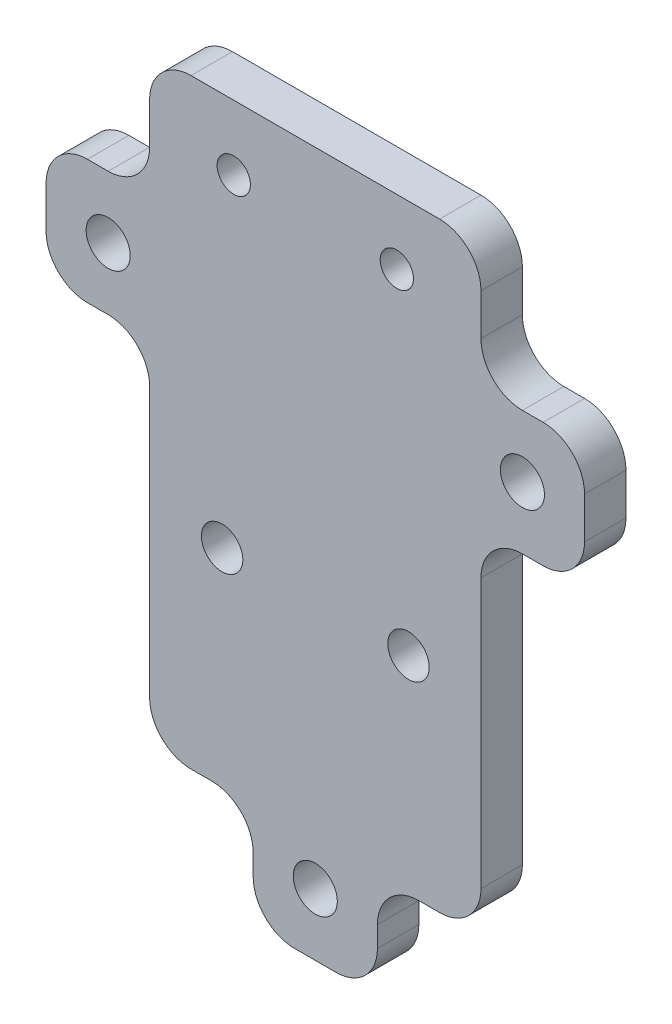
from build123d import *

# Parameters (mm, degrees)
SKETCH1_W                   = 50.8
SKETCH1_H                   = 101.6
BOSS_EXTRUDE1_DEPTH         = 6.35
F_7_0_201_DIAMETER_HOLE1_D  = 5.1054
SKETCH4_W                   = 15.875
SKETCH4_H                   = 19.05
SKETCH4_W_2                 = 19.05
SKETCH4_H_2                 = 15.875
BOSS_EXTRUDE2_DEPTH         = 6.35
F_1_4_CLEARANCE_HOLE1_D     = 6.7564
SKETCH7_W                   = 50.8
SKETCH7_H                   = 9.525
CUT_EXTRUDE1_DEPTH          = 122.689926144
FILLET1_R                   = 6.35
F_1_4_0_25_DIAMETER_HOLE1_D = 6.35


with BuildPart() as part:
    # Sketch1 → Boss-Extrude1 (new body)
    with BuildSketch(Plane.XY):
        with Locations((25.4, 50.8)):
            Rectangle(SKETCH1_W, SKETCH1_H)
    extrude(amount=BOSS_EXTRUDE1_DEPTH)

    # #7 (0.201) Diameter Hole1 (through all)
    with Locations(Plane.XY.offset(6.35)):
        with Locations((12.899999981, 82.13900006), (37.900000019, 82.13900006)):
            Hole(F_7_0_201_DIAMETER_HOLE1_D / 2)

    # Sketch4 → Boss-Extrude2 (add)
    with BuildSketch(Plane.XY.offset(6.35)):
        with Locations((-7.9375, 63.5)):
            Rectangle(SKETCH4_W, SKETCH4_H)
        with Locations((58.7375, 63.5)):
            Rectangle(SKETCH4_W, SKETCH4_H)
        with Locations((25.4, -7.9375)):
            Rectangle(SKETCH4_W_2, SKETCH4_H_2)
    extrude(amount=-BOSS_EXTRUDE2_DEPTH)

    # 1/4 Clearance Hole1 (through all)
    with Locations(Plane.XY.offset(6.35)):
        with Locations((-6.35, 63.5), (57.15, 63.5), (25.4, -6.35)):
            Hole(F_1_4_CLEARANCE_HOLE1_D / 2)

    # Sketch7 → Cut-Extrude1 (cut, through all)
    with BuildSketch(Plane(origin=(0, 0, 0), x_dir=(-1, 0, 0), z_dir=(0, 0, -1))):
        with Locations((-25.4, 96.8375)):
            Rectangle(SKETCH7_W, SKETCH7_H)
    extrude(amount=-CUT_EXTRUDE1_DEPTH, mode=Mode.SUBTRACT)

    # Fillet1
    fillet1_edges = [part.edges().sort_by_distance(p)[0] for p in [
        (-15.875, 73.025, 3.175),
        (-15.875, 53.975, 3.175),
        (0, 53.975, 3.175),
        (0, 73.025, 3.175),
        (50.8, 53.975, 3.175),
        (66.675, 53.975, 3.175),
        (66.675, 73.025, 3.175),
        (50.8, 73.025, 3.175),
        (34.925, -15.875, 3.175),
        (34.925, 0, 3.175),
        (15.875, 0, 3.175),
        (15.875, -15.875, 3.175),
        (50.8, 0, 3.175),
        (0, 0, 3.175),
        (50.8, 92.075, 3.175),
        (0, 92.075, 3.175),
    ]]
    fillet(fillet1_edges, radius=FILLET1_R)

    # 1/4 (0.25) Diameter Hole1 (through all)
    with Locations(Plane(origin=(0, 0, 0), x_dir=(-1, 0, 0), z_dir=(0, 0, -1))):
        with Locations((-39.6875, 31.75), (-11.1125, 31.75)):
            Hole(F_1_4_0_25_DIAMETER_HOLE1_D / 2)


solid = part.part
